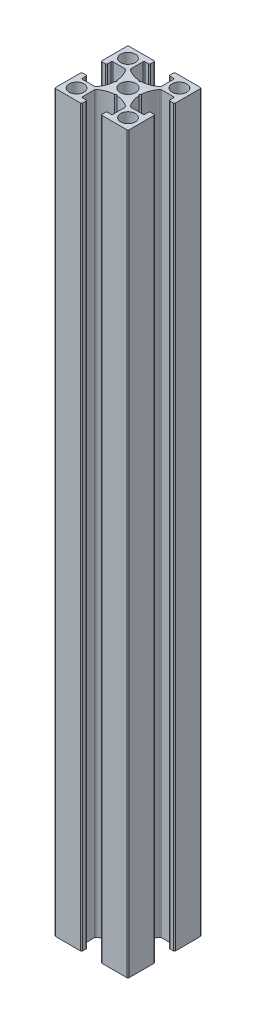
from build123d import *

# Parameters (mm, degrees)
SKETCH_1_R      = 2.15
SKETCH_1_R_2    = 2
EXTRUDE_1_DEPTH = 200


with BuildPart() as part:
    # 스케치1 → 보스-돌출1 (new body)
    with BuildSketch(Plane(origin=(0, 0, 0), x_dir=(1, 0, 0), z_dir=(0, 1, 0))):
        with BuildLine():
            Line((4.15, 4.942749448), (4.15, 8.2))
            ThreePointArc((4.15, 8.2), (4.062132034, 8.412132034), (3.85, 8.5))
            Line((3.85, 8.5), (2.95, 8.5))
            ThreePointArc((2.95, 8.5), (2.737867966, 8.587867966), (2.65, 8.8))
            Line((2.65, 8.8), (2.65, 9.7))
            ThreePointArc((2.65, 9.7), (2.737867966, 9.912132034), (2.95, 10))
            Line((2.95, 10), (9.7, 10))
            ThreePointArc((9.7, 10), (9.912132034, 9.912132034), (10, 9.7))
            Line((10, 9.7), (10, 2.95))
            ThreePointArc((10, 2.95), (9.912132034, 2.737867966), (9.7, 2.65))
            Line((9.7, 2.65), (8.8, 2.65))
            ThreePointArc((8.8, 2.65), (8.587867966, 2.737867966), (8.5, 2.95))
            Line((8.5, 2.95), (8.5, 3.85))
            ThreePointArc((8.5, 3.85), (8.412132034, 4.062132034), (8.2, 4.15))
            Line((8.2, 4.15), (4.942749448, 4.15))
            ThreePointArc((4.942749448, 4.15), (4.812307598, 4.120157221), (4.707817398, 4.03656616))
            ThreePointArc((4.707817398, 4.03656616), (3.714379176, 2.282021525), (3.307277366, 0.307277366))
            Line((3.307277366, 0.307277366), (3, 0))
            Line((3, 0), (3.307277366, -0.307277366))
            ThreePointArc((3.307277366, -0.307277366), (3.714379176, -2.282021525), (4.707817398, -4.03656616))
            ThreePointArc((4.707817398, -4.03656616), (4.812307598, -4.120157221), (4.942749448, -4.15))
            Line((4.942749448, -4.15), (8.2, -4.15))
            ThreePointArc((8.2, -4.15), (8.412132034, -4.062132034), (8.5, -3.85))
            Line((8.5, -3.85), (8.5, -2.95))
            ThreePointArc((8.5, -2.95), (8.587867966, -2.737867966), (8.8, -2.65))
            Line((8.8, -2.65), (9.7, -2.65))
            ThreePointArc((9.7, -2.65), (9.912132034, -2.737867966), (10, -2.95))
            Line((10, -2.95), (10, -9.7))
            ThreePointArc((10, -9.7), (9.912132034, -9.912132034), (9.7, -10))
            Line((9.7, -10), (2.95, -10))
            ThreePointArc((2.95, -10), (2.737867966, -9.912132034), (2.65, -9.7))
            Line((2.65, -9.7), (2.65, -8.8))
            ThreePointArc((2.65, -8.8), (2.737867966, -8.587867966), (2.95, -8.5))
            Line((2.95, -8.5), (3.85, -8.5))
            ThreePointArc((3.85, -8.5), (4.062132034, -8.412132034), (4.15, -8.2))
            Line((4.15, -8.2), (4.15, -4.942749448))
            ThreePointArc((4.15, -4.942749448), (4.120157221, -4.812307598), (4.03656616, -4.707817398))
            ThreePointArc((4.03656616, -4.707817398), (2.282021525, -3.714379176), (0.307277366, -3.307277366))
            Line((0.307277366, -3.307277366), (0, -3))
            Line((0, -3), (-0.307277366, -3.307277366))
            ThreePointArc((-0.307277366, -3.307277366), (-2.282021525, -3.714379176), (-4.03656616, -4.707817398))
            ThreePointArc((-4.03656616, -4.707817398), (-4.120157221, -4.812307598), (-4.15, -4.942749448))
            Line((-4.15, -4.942749448), (-4.15, -8.2))
            ThreePointArc((-4.15, -8.2), (-4.062132034, -8.412132034), (-3.85, -8.5))
            Line((-3.85, -8.5), (-2.95, -8.5))
            ThreePointArc((-2.95, -8.5), (-2.737867966, -8.587867966), (-2.65, -8.8))
            Line((-2.65, -8.8), (-2.65, -9.7))
            ThreePointArc((-2.65, -9.7), (-2.737867966, -9.912132034), (-2.95, -10))
            Line((-2.95, -10), (-9.7, -10))
            ThreePointArc((-9.7, -10), (-9.912132034, -9.912132034), (-10, -9.7))
            Line((-10, -9.7), (-10, -2.95))
            ThreePointArc((-10, -2.95), (-9.912132034, -2.737867966), (-9.7, -2.65))
            Line((-9.7, -2.65), (-8.8, -2.65))
            ThreePointArc((-8.8, -2.65), (-8.587867966, -2.737867966), (-8.5, -2.95))
            Line((-8.5, -2.95), (-8.5, -3.85))
            ThreePointArc((-8.5, -3.85), (-8.412132034, -4.062132034), (-8.2, -4.15))
            Line((-8.2, -4.15), (-4.942749448, -4.15))
            ThreePointArc((-4.942749448, -4.15), (-4.812307598, -4.120157221), (-4.707817398, -4.03656616))
            ThreePointArc((-4.707817398, -4.03656616), (-3.714379176, -2.282021525), (-3.307277366, -0.307277366))
            Line((-3.307277366, -0.307277366), (-3, 0))
            Line((-3, 0), (-3.307277366, 0.307277366))
            ThreePointArc((-3.307277366, 0.307277366), (-3.714379176, 2.282021525), (-4.707817398, 4.03656616))
            ThreePointArc((-4.707817398, 4.03656616), (-4.812307598, 4.120157221), (-4.942749448, 4.15))
            Line((-4.942749448, 4.15), (-8.2, 4.15))
            ThreePointArc((-8.2, 4.15), (-8.412132034, 4.062132034), (-8.5, 3.85))
            Line((-8.5, 3.85), (-8.5, 2.95))
            ThreePointArc((-8.5, 2.95), (-8.587867966, 2.737867966), (-8.8, 2.65))
            Line((-8.8, 2.65), (-9.7, 2.65))
            ThreePointArc((-9.7, 2.65), (-9.912132034, 2.737867966), (-10, 2.95))
            Line((-10, 2.95), (-10, 9.7))
            ThreePointArc((-10, 9.7), (-9.912132034, 9.912132034), (-9.7, 10))
            Line((-9.7, 10), (-2.95, 10))
            ThreePointArc((-2.95, 10), (-2.737867966, 9.912132034), (-2.65, 9.7))
            Line((-2.65, 9.7), (-2.65, 8.8))
            ThreePointArc((-2.65, 8.8), (-2.737867966, 8.587867966), (-2.95, 8.5))
            Line((-2.95, 8.5), (-3.85, 8.5))
            ThreePointArc((-3.85, 8.5), (-4.062132034, 8.412132034), (-4.15, 8.2))
            Line((-4.15, 8.2), (-4.15, 4.942749448))
            ThreePointArc((-4.15, 4.942749448), (-4.120157221, 4.812307598), (-4.03656616, 4.707817398))
            ThreePointArc((-4.03656616, 4.707817398), (-2.282021525, 3.714379176), (-0.307277366, 3.307277366))
            Line((-0.307277366, 3.307277366), (0, 3))
            Line((0, 3), (0.307277366, 3.307277366))
            ThreePointArc((0.307277366, 3.307277366), (2.282021525, 3.714379176), (4.03656616, 4.707817398))
            ThreePointArc((4.03656616, 4.707817398), (4.120157221, 4.812307598), (4.15, 4.942749448))
        make_face()
        with Locations(Location((0, 0, 0), (0, 0, 270))):
            Circle(SKETCH_1_R, mode=Mode.SUBTRACT)
        with Locations(Location((-7, 7, 0), (0, 0, 270))):
            Circle(SKETCH_1_R_2, mode=Mode.SUBTRACT)
        with Locations(Location((-7, -7, 0), (0, 0, 270))):
            Circle(SKETCH_1_R_2, mode=Mode.SUBTRACT)
        with Locations(Location((7, 7, 0), (0, 0, 270))):
            Circle(SKETCH_1_R_2, mode=Mode.SUBTRACT)
        with Locations(Location((7, -7, 0), (0, 0, 270))):
            Circle(SKETCH_1_R_2, mode=Mode.SUBTRACT)
    extrude(amount=EXTRUDE_1_DEPTH)


solid = part.part
